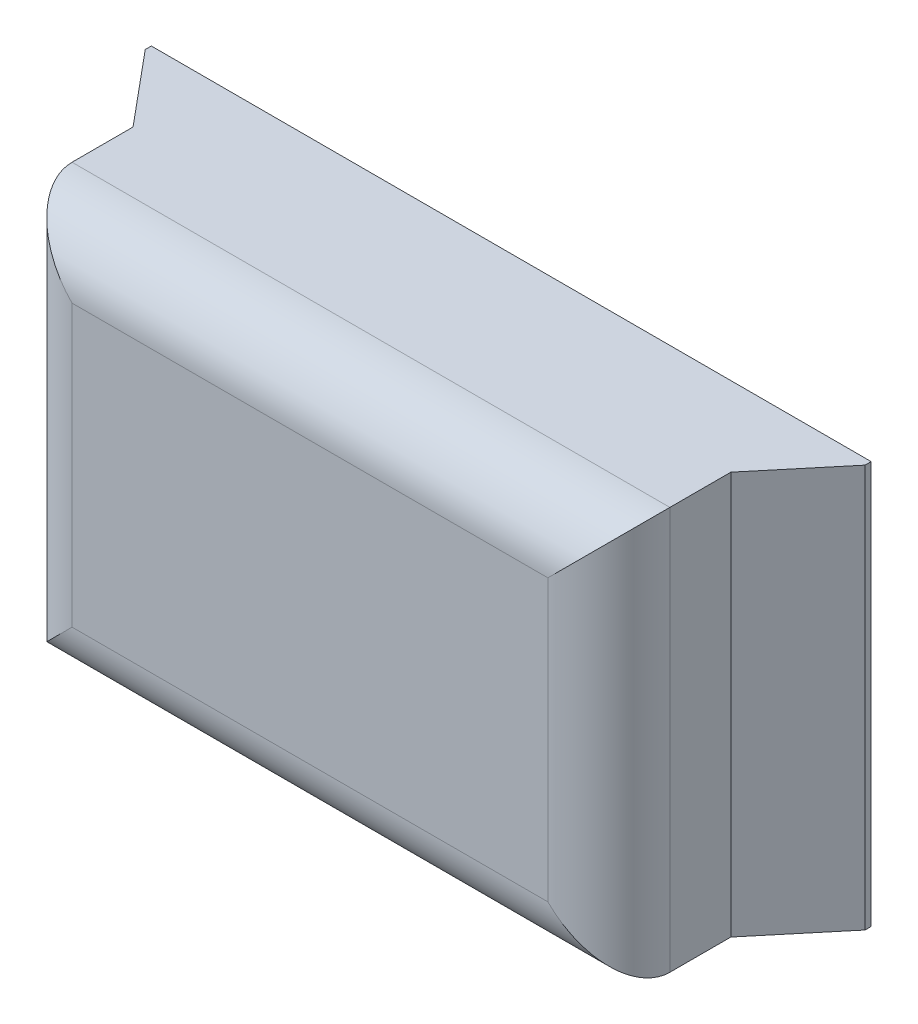
from build123d import *

# Parameters (mm, degrees)
BOSS_EXTRUDE1_DEPTH = 3.3
FILLET1_R           = 0.5
SKETCH2_W           = 2.471601058
SKETCH2_H           = 2.200098802
CUT_EXTRUDE1_DEPTH  = 0.46


with BuildPart() as part:
    # Sketch1 → Boss-Extrude1 (new body)
    with BuildSketch(Plane(origin=(0, 0, 0), x_dir=(1, 0, 0), z_dir=(0, 1, 0))):
        Polygon((-19.154390691, -8.897595786), (-14.254390691, -8.897595786), (-14.254390691, -7.897595786), (-13.754390691, -7.297595786), (-13.754390691, -7.247595786), (-19.654390691, -7.247595786), (-19.654390691, -7.297595786), (-19.154390691, -7.897595786), align=None)
    extrude(amount=BOSS_EXTRUDE1_DEPTH)

    # Fillet1
    fillet1_edges = [part.edges().sort_by_distance(p)[0] for p in [
        (-14.254390691, 1.65, 8.897595786),
        (-19.154390691, 1.65, 8.897595786),
        (-16.704390691, 3.3, 8.897595786),
        (-16.704390691, 0, 8.897595786),
    ]]
    fillet(fillet1_edges, radius=FILLET1_R)

    # Sketch2 → Cut-Extrude1 (cut)
    with BuildSketch(Plane(origin=(0, 0, 7.247595786), x_dir=(-1, 0, 0), z_dir=(0, 0, -1))):
        with Locations((16.704390691, 1.65)):
            Rectangle(SKETCH2_W, SKETCH2_H)
    extrude(amount=-CUT_EXTRUDE1_DEPTH, mode=Mode.SUBTRACT)


solid = part.part
